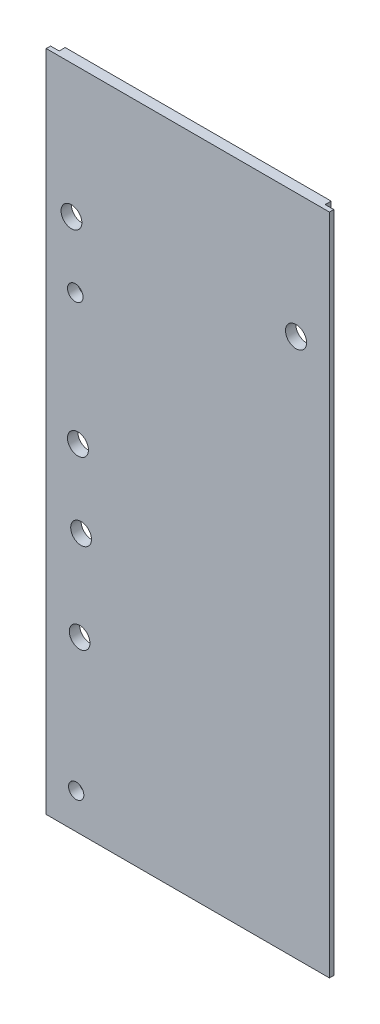
from build123d import *

# Parameters (mm, degrees)
SKETCH1_W           = 520.61
SKETCH1_H           = 1219.2
SKETCH1_R           = 14.035
SKETCH1_R_2         = 19.005
SKETCH1_R_3         = 19.085
SKETCH1_R_4         = 19.265
SKETCH1_R_5         = 14.26
SKETCH1_R_6         = 19.135
SKETCH1_R_7         = 19.38
BOSS_EXTRUDE1_DEPTH = 19.05
SKETCH1_3_W         = 15.83
SKETCH1_3_H         = 1219.2
CUT_EXTRUDE1_DEPTH  = 11.05


with BuildPart() as part:
    # Sketch1 → Boss-Extrude1 (new body)
    with BuildSketch(Plane.XY):
        with Locations((-244.475, -609.6)):
            Rectangle(SKETCH1_W, SKETCH1_H)
        with Locations((-449.645, -1153.86)):
            Circle(SKETCH1_R, mode=Mode.SUBTRACT)
        with Locations((-443.355, -906.4175)):
            Circle(SKETCH1_R_2, mode=Mode.SUBTRACT)
        with Locations((-440.665, -739.81)):
            Circle(SKETCH1_R_3, mode=Mode.SUBTRACT)
        with Locations((-446.415, -600.29)):
            Circle(SKETCH1_R_4, mode=Mode.SUBTRACT)
        with Locations((-451.35, -361.9225)):
            Circle(SKETCH1_R_5, mode=Mode.SUBTRACT)
        with Locations((-458.365, -244.56)):
            Circle(SKETCH1_R_6, mode=Mode.SUBTRACT)
        with Locations((-45.58, -228.93)):
            Circle(SKETCH1_R_7, mode=Mode.SUBTRACT)
    extrude(amount=BOSS_EXTRUDE1_DEPTH)

    # Sketch1<3> → Cut-Extrude1 (cut)
    with BuildSketch(Plane.XY):
        with Locations((7.915, -609.6)):
            Rectangle(SKETCH1_3_W, SKETCH1_3_H)
        with Locations((-496.865, -609.6)):
            Rectangle(SKETCH1_3_W, SKETCH1_3_H)
    extrude(amount=CUT_EXTRUDE1_DEPTH, mode=Mode.SUBTRACT)


solid = part.part
